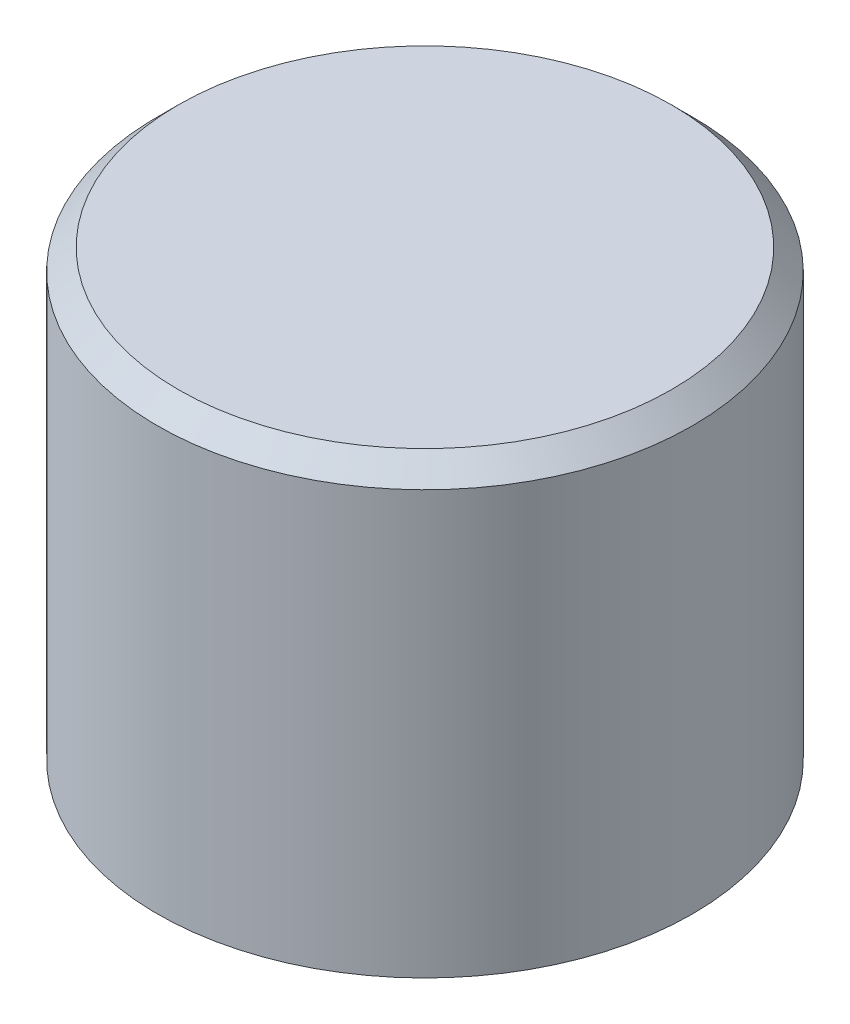
from build123d import *

# Parameters (mm, degrees)
CHAMFER_1_SIZE = 0.8


with BuildPart() as part:
    # Эскиз1 → Повернуть1 (revolve)
    with BuildSketch(Plane.XY, mode=Mode.PRIVATE) as revolve_1_sk:
        Polygon((-2.5, 5.5), (-2.5, 15), (0, 15), (0, 17), (-10.25, 17), (-10.25, 0), (-9.85, 0), (-9.85, 5.5), align=None)
    revolve(revolve_1_sk.sketch.rotate(Axis((0, 15, 0), (0, 1, 0)), 180), axis=Axis((0, 15, 0), (0, 1, 0)))

    # Фаска1
    chamfer_1_edges = [part.edges().sort_by_distance(p)[0] for p in [
        (-10.25, 17, 0),
    ]]
    chamfer(chamfer_1_edges, length=CHAMFER_1_SIZE)


solid = part.part
